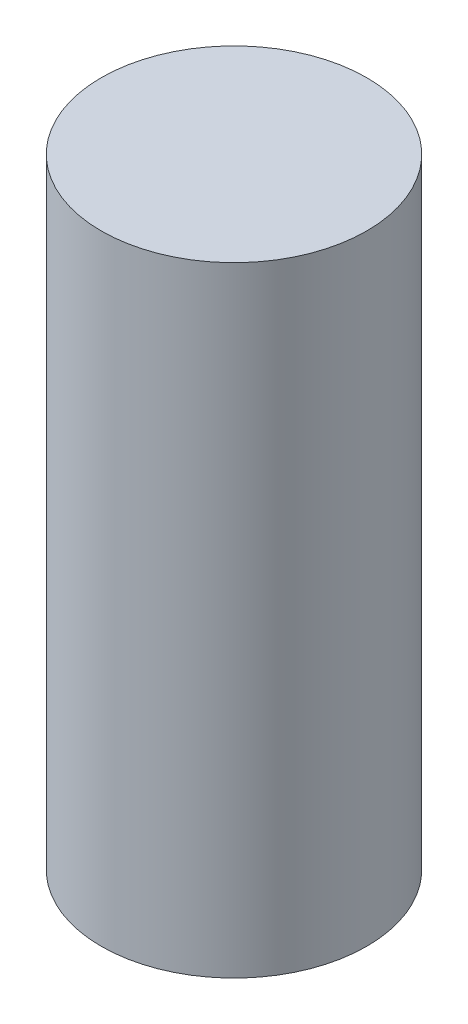
from build123d import *

# Parameters (mm, degrees)
PACK_AYAR_MIL_3_START = 12
SKETCH1_R             = 6
PACK_AYAR_MIL_3_DEPTH = 28


with BuildPart() as part:
    # Sketch1 → PACK_ayar_mil_3 (new body)
    with BuildSketch(Plane(origin=(0, 0, 0), x_dir=(1, 0, 0), z_dir=(0, 1, 0)).offset(PACK_AYAR_MIL_3_START)):
        with Locations(Location((50, 770, 0), (0, 0, 270))):
            Circle(SKETCH1_R)
    extrude(amount=PACK_AYAR_MIL_3_DEPTH)


solid = part.part
